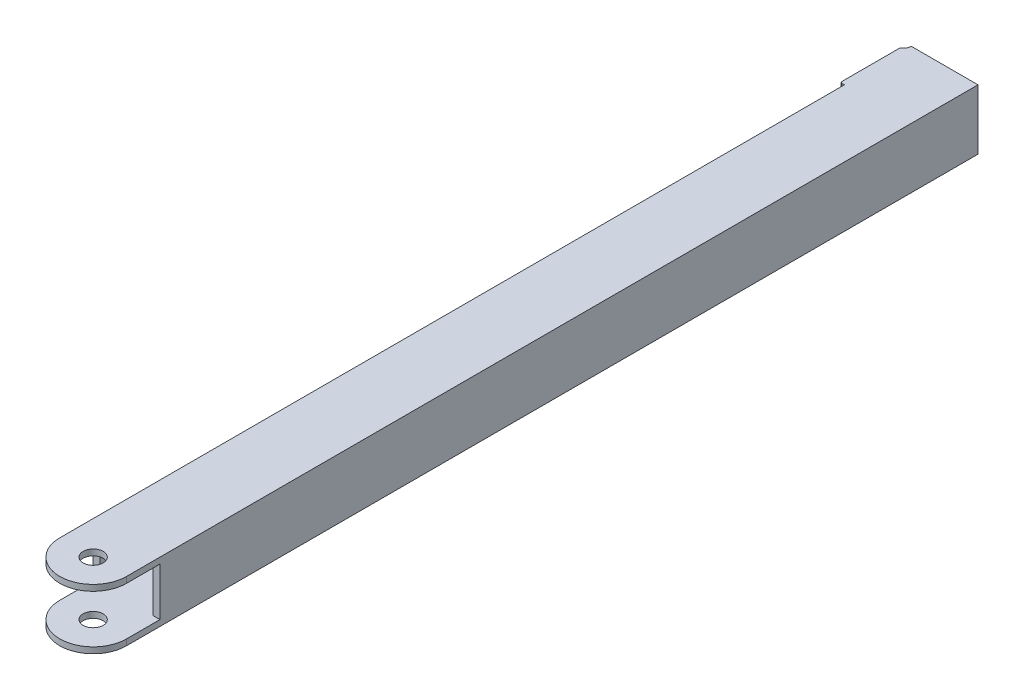
from build123d import *

# Parameters (mm, degrees)
SKETCH1_W               = 40
SKETCH1_H               = 36
SKETCH1_W_2             = 32
SKETCH1_H_2             = 28.8
BOSS_EXTRUDE1_DEPTH     = 530
SKETCH2_W               = 50
SKETCH2_H               = 28.8
CUT_EXTRUDE1_DEPTH      = 40
FILLET2_RADIUS          = 20
FILLET2_LENGTH          = 3.6
FILLET3_RADIUS          = 20
FILLET3_LENGTH          = 3.6
CUT_EXTRUDE2_DEPTH      = 532.597592169
CUT_EXTRUDE2_DEPTH_BACK = 532.597592169
SKETCH3_R               = 6
CUT_EXTRUDE3_DEPTH      = 10
SKETCH12_R              = 2.5
BOSS_EXTRUDE3_DEPTH     = 36
CUT_EXTRUDE6_START      = -9
SKETCH13_R              = 5
CUT_EXTRUDE6_DEPTH      = 9
CUT_EXTRUDE7_START      = -9
SKETCH14_R              = 5
CUT_EXTRUDE7_DEPTH      = 9
FILLET6_R               = 1


with BuildPart() as part:
    # Sketch1 → Boss-Extrude1 (new body)
    with BuildSketch(Plane.XY):
        Rectangle(SKETCH1_W, SKETCH1_H)
        Rectangle(SKETCH1_W_2, SKETCH1_H_2, mode=Mode.SUBTRACT)
    extrude(amount=BOSS_EXTRUDE1_DEPTH)

    # Sketch2 → Cut-Extrude1 (cut)
    with BuildSketch(Plane.XY.offset(530)):
        Rectangle(SKETCH2_W, SKETCH2_H)
    extrude(amount=-CUT_EXTRUDE1_DEPTH, mode=Mode.SUBTRACT)

    # Fillet2: full round fillet: the end face becomes a half cylinder, R = half its width
    fillet2_face = Plane((0, -16.2, 530), x_dir=(0, -1, 0), z_dir=(0, 0, 1))  # on the end face: x along it, z out of the body
    fillet2_slab = fillet2_face.offset(-FILLET2_RADIUS / 2) * Box(FILLET2_LENGTH, 2 * FILLET2_RADIUS, FILLET2_RADIUS, mode=Mode.PRIVATE)  # the body's end, R deep
    fillet2_round = Plane((0, -16.2, 510), x_dir=(0, 0, 1), z_dir=(0, -1, 0)) * Cylinder(FILLET2_RADIUS, FILLET2_LENGTH, mode=Mode.PRIVATE)  # its axis R under the face
    add(fillet2_slab - fillet2_round, mode=Mode.SUBTRACT)

    # Fillet3: full round fillet: the end face becomes a half cylinder, R = half its width
    fillet3_face = Plane((0, 16.2, 530), x_dir=(0, -1, 0), z_dir=(0, 0, 1))  # on the end face: x along it, z out of the body
    fillet3_slab = fillet3_face.offset(-FILLET3_RADIUS / 2) * Box(FILLET3_LENGTH, 2 * FILLET3_RADIUS, FILLET3_RADIUS, mode=Mode.PRIVATE)  # the body's end, R deep
    fillet3_round = Plane((0, 16.2, 510), x_dir=(0, 0, 1), z_dir=(0, -1, 0)) * Cylinder(FILLET3_RADIUS, FILLET3_LENGTH, mode=Mode.PRIVATE)  # its axis R under the face
    add(fillet3_slab - fillet3_round, mode=Mode.SUBTRACT)

    # Sketch3 → Cut-Extrude2 (cut, two sides: drawn at the far end of the back side and taken through both)
    with BuildSketch(Plane(origin=(0, 18, 0), x_dir=(1, 0, 0), z_dir=(0, 1, 0)).offset(-CUT_EXTRUDE2_DEPTH_BACK)):
        with Locations(Location((0, -510, 0), (0, 0, 270))):
            Circle(SKETCH3_R)
    extrude(amount=CUT_EXTRUDE2_DEPTH + CUT_EXTRUDE2_DEPTH_BACK, mode=Mode.SUBTRACT)

    # Sketch6 → Cut-Extrude3 (cut)
    with BuildSketch(Plane.XZ.offset(18)):
        with BuildLine():
            ThreePointArc((6, 460), (0, 466), (-6, 460))
            Line((-6, 460), (-6, 360))
            ThreePointArc((-6, 360), (0, 354), (6, 360))
            Line((6, 360), (6, 460))
        make_face()
    extrude(amount=-CUT_EXTRUDE3_DEPTH, mode=Mode.SUBTRACT)

    # Sketch12 → Boss-Extrude3 (add)
    with BuildSketch(Plane.XZ.offset(18)):
        with BuildLine():
            Line((-20, 0), (-20, 40))
            Line((-20, 40), (-22.5, 40))
            Line((-22.5, 40), (-22.5, 4.330127019))
            ThreePointArc((-22.5, 4.330127019), (-29.330127019, -2.5), (-20, 0))
        make_face()
        with Locations(Location((-25, 0, 0), (0, 0, 270))):
            Circle(SKETCH12_R, mode=Mode.SUBTRACT)
    extrude(amount=-BOSS_EXTRUDE3_DEPTH)

    # Sketch13 → Cut-Extrude6 (cut)
    with BuildSketch(Plane(origin=(0, 18, 0), x_dir=(1, 0, 0), z_dir=(0, 1, 0)).offset(CUT_EXTRUDE6_START)):
        with Locations((-25, 0)):
            Circle(SKETCH13_R)
    extrude(amount=CUT_EXTRUDE6_DEPTH, mode=Mode.SUBTRACT)

    # Sketch14 → Cut-Extrude7 (cut)
    with BuildSketch(Plane(origin=(0, 0, 0), x_dir=(1, 0, 0), z_dir=(0, 1, 0)).offset(CUT_EXTRUDE7_START)):
        with Locations((-25, 0)):
            Circle(SKETCH14_R)
    extrude(amount=CUT_EXTRUDE7_DEPTH, mode=Mode.SUBTRACT)

    # Fillet6
    fillet6_edges = [part.edges().sort_by_distance(p)[0] for p in [
        (-22.5, 0, 40),
    ]]
    fillet(fillet6_edges, radius=FILLET6_R)


solid = part.part
